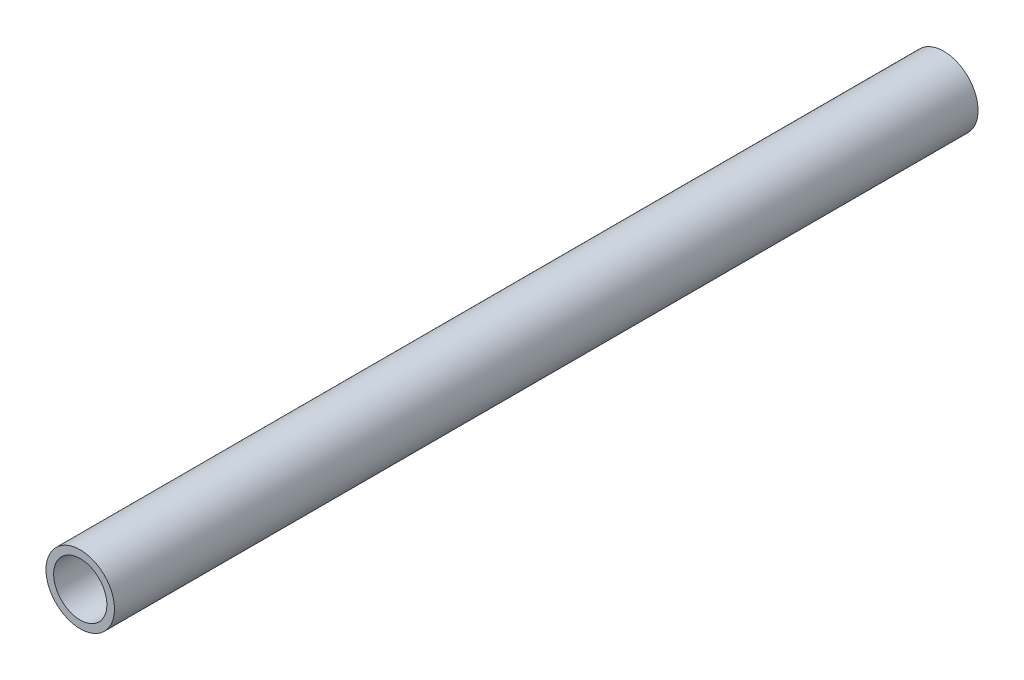
from build123d import *

# Parameters (mm, degrees)
SKETCH1_R           = 9
SKETCH1_R_2         = 7
BOSS_EXTRUDE1_DEPTH = 227


with BuildPart() as part:
    # Sketch1 → Boss-Extrude1 (new body)
    with BuildSketch(Plane.XY):
        with Locations(Location((0, 0, 0), (0, 0, 180))):
            Circle(SKETCH1_R)
        with Locations(Location((0, 0, 0), (0, 0, 180))):
            Circle(SKETCH1_R_2, mode=Mode.SUBTRACT)
    extrude(amount=BOSS_EXTRUDE1_DEPTH)


solid = part.part
